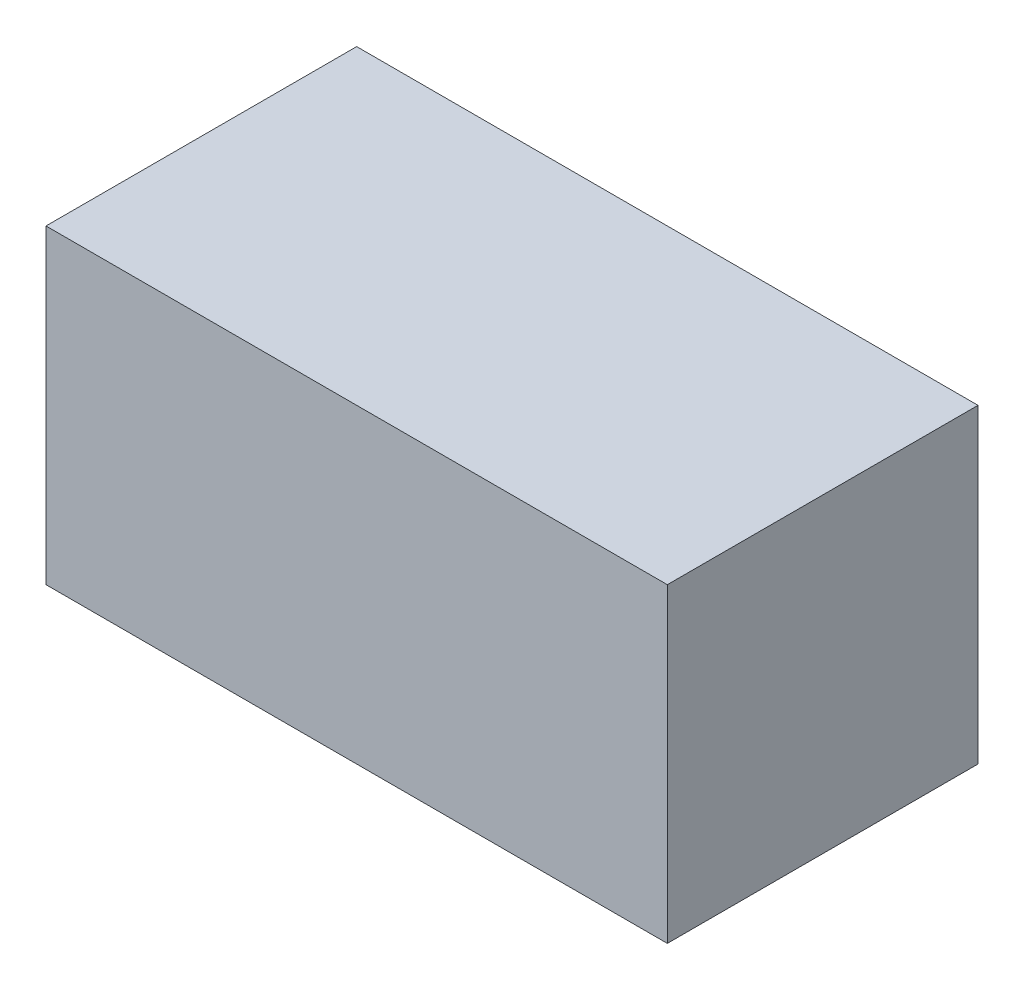
from build123d import *

# Parameters (mm, degrees)
SKETCH1_W           = 0.8
SKETCH1_H           = 0.4
BOSS_EXTRUDE1_DEPTH = 0.4


with BuildPart() as part:
    # Sketch1 → Boss-Extrude1 (new body)
    with BuildSketch(Plane(origin=(0, 0, 0), x_dir=(1, 0, 0), z_dir=(0, 1, 0))):
        with Locations((0.4, 0.2)):
            Rectangle(SKETCH1_W, SKETCH1_H)
    extrude(amount=BOSS_EXTRUDE1_DEPTH)


solid = part.part
